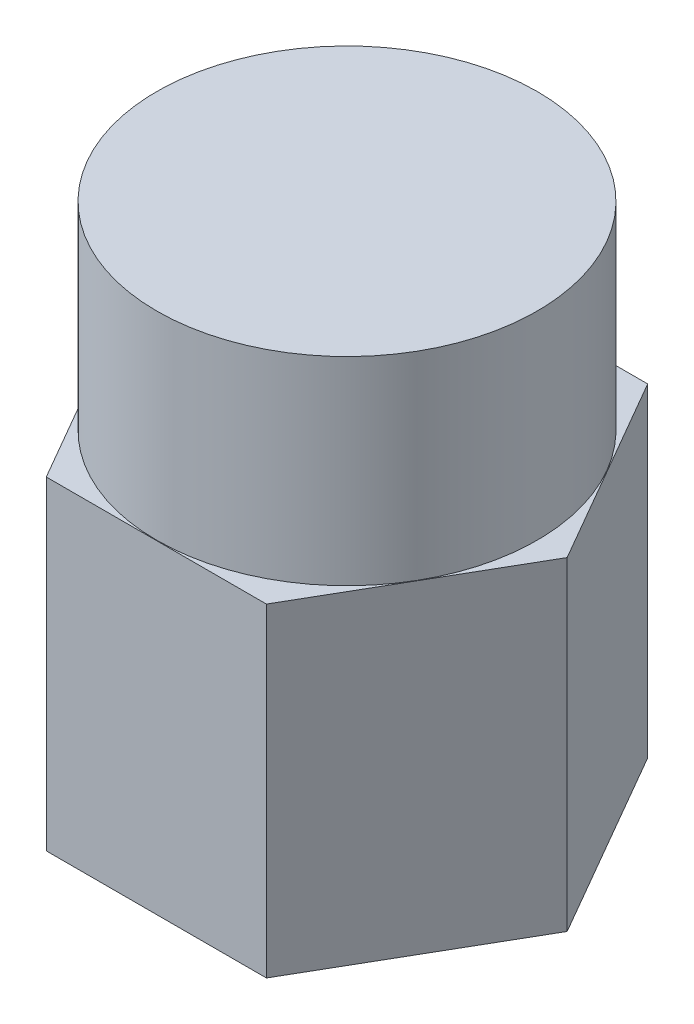
from build123d import *

# Parameters (mm, degrees)
BOSS_EXTRUDE1_DEPTH = 18.6
SKETCH2_R           = 10.925
BOSS_EXTRUDE2_DEPTH = 11.4


with BuildPart() as part:
    # Sketch1 → Boss-Extrude1 (new body)
    with BuildSketch(Plane(origin=(0, 0, 0), x_dir=(1, 0, 0), z_dir=(0, 1, 0))):
        Polygon((12.643970895, 0), (6.321985448, 10.95), (-6.321985448, 10.95), (-12.643970895, 0), (-6.321985448, -10.95), (6.321985448, -10.95), align=None)
    extrude(amount=BOSS_EXTRUDE1_DEPTH)

    # Sketch2 → Boss-Extrude2 (add)
    with BuildSketch(Plane(origin=(0, 18.6, 0), x_dir=(1, 0, 0), z_dir=(0, 1, 0))):
        with Locations(Location((0, 0, 0), (0, 0, 270))):
            Circle(SKETCH2_R)
    extrude(amount=BOSS_EXTRUDE2_DEPTH)


solid = part.part
